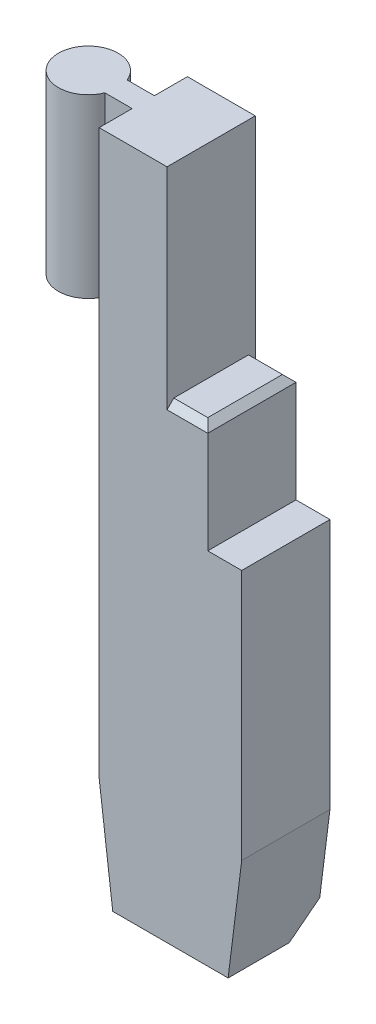
from build123d import *

# Parameters (mm, degrees)
SZKIC1_W                    = 10.5
SZKIC1_H                    = 40
DODANIE_WYCI_GNI_CIE1_DEPTH = 6.5
SZKIC2_W                    = 2.5
SZKIC2_H                    = 8
WYTNIJ_WYCI_GNI_CIE1_DEPTH  = 6.5
SFAZOWANIE1_SIZE            = 0.5
DODANIE_WYCI_GNI_CIE2_DEPTH = 13
SZKIC4_W                    = 10.5
SZKIC4_H                    = 9.5
DODANIE_WYCI_GNI_CIE3_DEPTH = 6.5
SFAZOWANIE2_SIZE            = 8
SFAZOWANIE2_SIZE2           = 1
SFAZOWANIE3_SIZE            = 1
SFAZOWANIE3_SIZE2           = 8
SFAZOWANIE4_SIZE            = 2


with BuildPart() as part:
    # Szkic1 → Dodanie-wyciągnięcie1 (new body)
    with BuildSketch(Plane.XY):
        Rectangle(SZKIC1_W, SZKIC1_H)
    extrude(amount=DODANIE_WYCI_GNI_CIE1_DEPTH)

    # Szkic2 → Wytnij-wyciągnięcie1 (cut)
    with BuildSketch(Plane.XY.offset(6.5)):
        with Locations((4, 1)):
            Rectangle(SZKIC2_W, SZKIC2_H)
        Polygon((5.25, 20), (-0.25, 20), (-0.25, 5), (2.75, 5), (5.25, 5), align=None)
    extrude(amount=-WYTNIJ_WYCI_GNI_CIE1_DEPTH, mode=Mode.SUBTRACT)

    # Sfazowanie1
    sfazowanie1_edges = [part.edges().sort_by_distance(p)[0] for p in [
        (1.25, 5, 0),
        (2.75, 5, 3.25),
        (1.25, 5, 6.5),
    ]]
    chamfer(sfazowanie1_edges, length=SFAZOWANIE1_SIZE)

    # Szkic3 → Dodanie-wyciągnięcie2 (add)
    with BuildSketch(Plane(origin=(0, 20, 0), x_dir=(1, 0, 0), z_dir=(0, 1, 0))):
        with BuildLine():
            ThreePointArc((-7.258694583, -2.429590228), (-11.5, -3.25), (-7.258694583, -4.070409772))
            Line((-7.258694583, -4.070409772), (-9.3, -4.070409772))
            Line((-9.3, -4.070409772), (-9.3, -2.429590228))
            Line((-9.3, -2.429590228), (-7.258694583, -2.429590228))
        make_face()
        with BuildLine():
            Line((-9.3, -4.070409772), (-7.258694583, -4.070409772))
            ThreePointArc((-7.258694583, -4.070409772), (-7.140037973, -3.667808618), (-7.1, -3.25))
            ThreePointArc((-7.1, -3.25), (-7.140037973, -2.832191382), (-7.258694583, -2.429590228))
            Line((-7.258694583, -2.429590228), (-9.3, -2.429590228))
            Line((-9.3, -2.429590228), (-9.3, -4.070409772))
        make_face()
        with BuildLine():
            Line((-7.258694583, -4.070409772), (-5.25, -4.070409772))
            Line((-5.25, -4.070409772), (-5.25, -2.429590228))
            Line((-5.25, -2.429590228), (-7.258694583, -2.429590228))
            ThreePointArc((-7.258694583, -2.429590228), (-7.140037973, -2.832191382), (-7.1, -3.25))
            ThreePointArc((-7.1, -3.25), (-7.140037973, -3.667808618), (-7.258694583, -4.070409772))
        make_face()
    extrude(amount=-DODANIE_WYCI_GNI_CIE2_DEPTH)

    # Szkic4 → Dodanie-wyciągnięcie3 (add)
    with BuildSketch(Plane.XY.offset(6.5)):
        with Locations((0, -24.75)):
            Rectangle(SZKIC4_W, SZKIC4_H)
    extrude(amount=-DODANIE_WYCI_GNI_CIE3_DEPTH)

    # Sfazowanie2
    sfazowanie2_edges = [part.edges().sort_by_distance(p)[0] for p in [
        (5.25, -29.5, 3.25),
    ]]
    sfazowanie2_side = [part.faces().sort_by_distance(p)[0] for p in [
        (5.25, -16.25, 3.25),
    ]]
    chamfer(sfazowanie2_edges, length=SFAZOWANIE2_SIZE, length2=SFAZOWANIE2_SIZE2, reference=sfazowanie2_side[0])

    # Sfazowanie3
    sfazowanie3_edges = [part.edges().sort_by_distance(p)[0] for p in [
        (-5.25, -29.5, 3.25),
    ]]
    sfazowanie3_side = [part.faces().sort_by_distance(p)[0] for p in [
        (-0.5, -29.5, 3.25),
    ]]
    chamfer(sfazowanie3_edges, length=SFAZOWANIE3_SIZE, length2=SFAZOWANIE3_SIZE2, reference=sfazowanie3_side[0])

    # Sfazowanie4
    sfazowanie4_edges = [part.edges().sort_by_distance(p)[0] for p in [
        (0, -29.5, 0),
    ]]
    chamfer(sfazowanie4_edges, length=SFAZOWANIE4_SIZE)


solid = part.part
